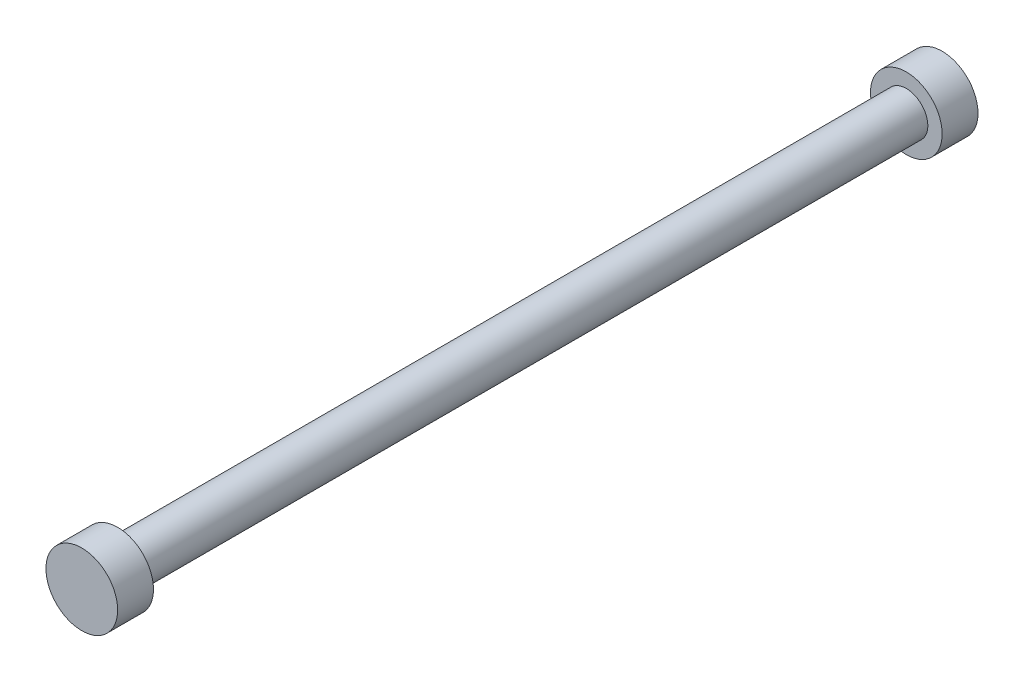
from build123d import *

# Parameters (mm, degrees)
SKETCH1_R           = 3
BOSS_EXTRUDE1_DEPTH = 57.5
SKETCH2_R           = 5
BOSS_EXTRUDE2_DEPTH = 2.5


with BuildPart() as part:
    # Sketch1 → Boss-Extrude1 (new, symmetric)
    with BuildSketch(Plane.XY):
        Circle(SKETCH1_R)
    extrude(amount=BOSS_EXTRUDE1_DEPTH, both=True)

    # Sketch2 → Boss-Extrude2 (add, symmetric)
    with BuildSketch(Plane.XY.offset(57.5)):
        Circle(SKETCH2_R)
    boss_extrude2 = extrude(amount=BOSS_EXTRUDE2_DEPTH, both=True)

    # Mirror1: Boss-Extrude2 across plane
    add(boss_extrude2.mirror(Plane.XY))


solid = part.part
